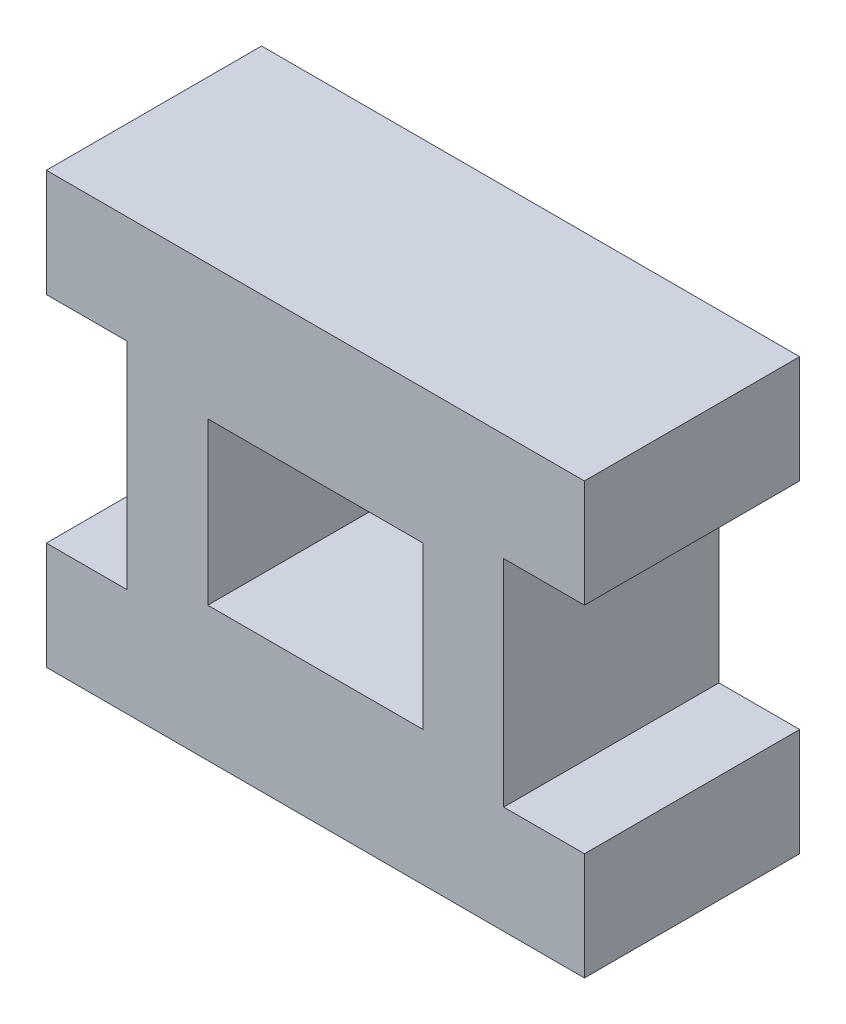
from build123d import *

# Parameters (mm, degrees)
SKETCH1_W           = 40
SKETCH1_H           = 30
BOSS_EXTRUDE1_DEPTH = 40


with BuildPart() as part:
    # Sketch1 → Boss-Extrude1 (new body)
    with BuildSketch(Plane.XY):
        Polygon((-34.041262383, 29.361382279), (65.958737617, 29.361382279), (65.958737617, 9.361382279), (50.958737617, 9.361382279), (50.958737617, -30.638617721), (65.958737617, -30.638617721), (65.958737617, -50.638617721), (-34.041262383, -50.638617721), (-34.041262383, -30.638617721), (-19.041262383, -30.638617721), (-19.041262383, 9.361382279), (-34.041262383, 9.361382279), align=None)
        with Locations((15.958737617, -10.638617721)):
            Rectangle(SKETCH1_W, SKETCH1_H, mode=Mode.SUBTRACT)
    extrude(amount=BOSS_EXTRUDE1_DEPTH)


solid = part.part
